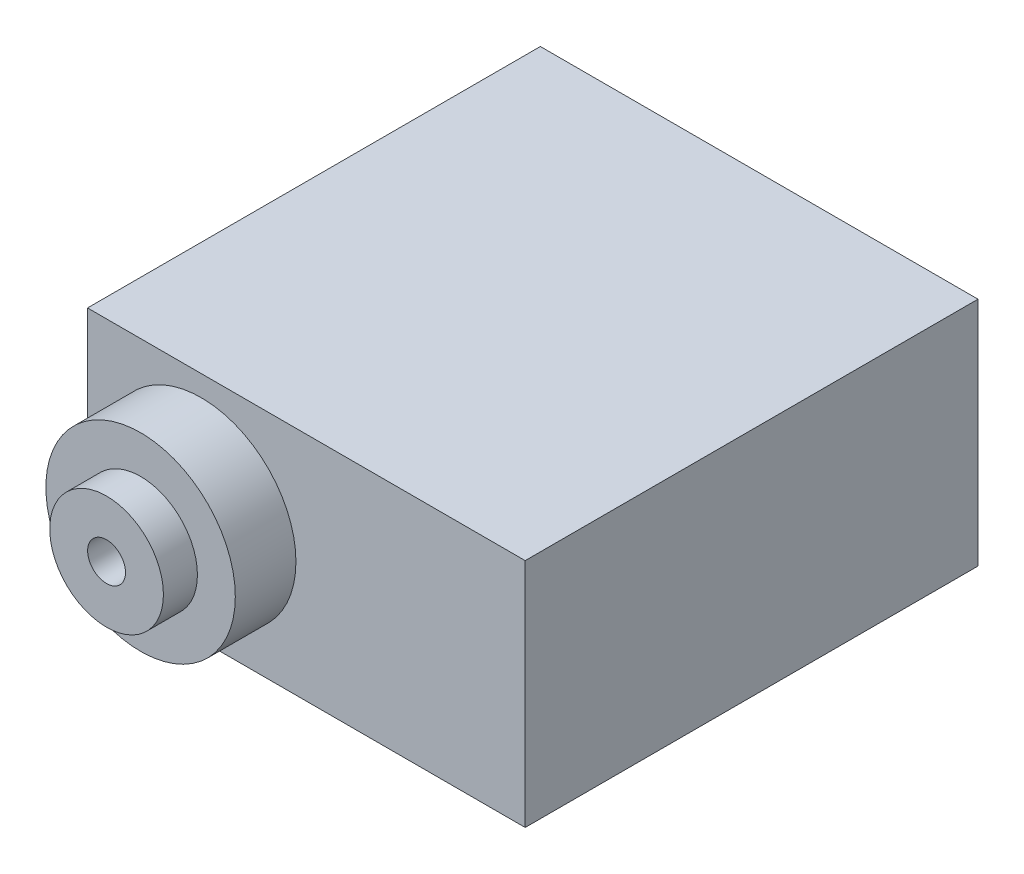
from build123d import *

# Parameters (mm, degrees)
SKETCH_1_W          = 23.1
SKETCH_1_H          = 12.2
EXTRUDE_1_DEPTH     = 27.1
SKETCH_2_R          = 5
EXTRUDE_2_DEPTH     = 3.2
SKETCH_3_W          = 23.1
SKETCH_3_H          = 12.2
CUT_EXTRUDE_1_DEPTH = 3.2
SKETCH_4_R          = 3
CUT_EXTRUDE_2_DEPTH = 3.2
EXTRUDE_START       = 4.995444433
SKETCH_5_R          = 3
EXTRUDE_3_DEPTH     = 4.995444433
SKETCH_7_R          = 1
CUT_EXTRUDE_3_DEPTH = 5


with BuildPart() as part:
    # 草图1 → 凸台-拉伸1 (new body)
    with BuildSketch(Plane.XY):
        with Locations((-0.26021144, -3.034725608)):
            Rectangle(SKETCH_1_W, SKETCH_1_H)
    extrude(amount=-EXTRUDE_1_DEPTH)

    # 草图2 → 凸台-拉伸2 (add)
    with BuildSketch(Plane.XY):
        with Locations((-5.81021144, -3.034725608)):
            Circle(SKETCH_2_R)
    extrude(amount=EXTRUDE_2_DEPTH)

    # 草图3 → 切除-拉伸1 (cut)
    with BuildSketch(Plane(origin=(0, 0, -27.1), x_dir=(-1, 0, 0), z_dir=(0, 0, -1))):
        with Locations((0.26021144, -3.034725608)):
            Rectangle(SKETCH_3_W, SKETCH_3_H)
    extrude(amount=-CUT_EXTRUDE_1_DEPTH, mode=Mode.SUBTRACT)

    # 草图4 → 切除-拉伸2 (cut)
    with BuildSketch(Plane.XY.offset(3.2)):
        with Locations((-5.81021144, -3.034725608)):
            Circle(SKETCH_4_R)
    extrude(amount=-CUT_EXTRUDE_2_DEPTH, mode=Mode.SUBTRACT)

    # 草图5 → 凸台-拉伸3 (add)
    with BuildSketch(Plane.XY.offset(EXTRUDE_START)):
        with Locations((-5.81021144, -3.034725608)):
            Circle(SKETCH_5_R)
    extrude(amount=-EXTRUDE_3_DEPTH)

    # 草图7 → 切除-拉伸3 (cut)
    with BuildSketch(Plane.XY.offset(4.995444433)):
        with Locations((-5.81021144, -3.034725608)):
            Circle(SKETCH_7_R)
    extrude(amount=-CUT_EXTRUDE_3_DEPTH, mode=Mode.SUBTRACT)


solid = part.part
